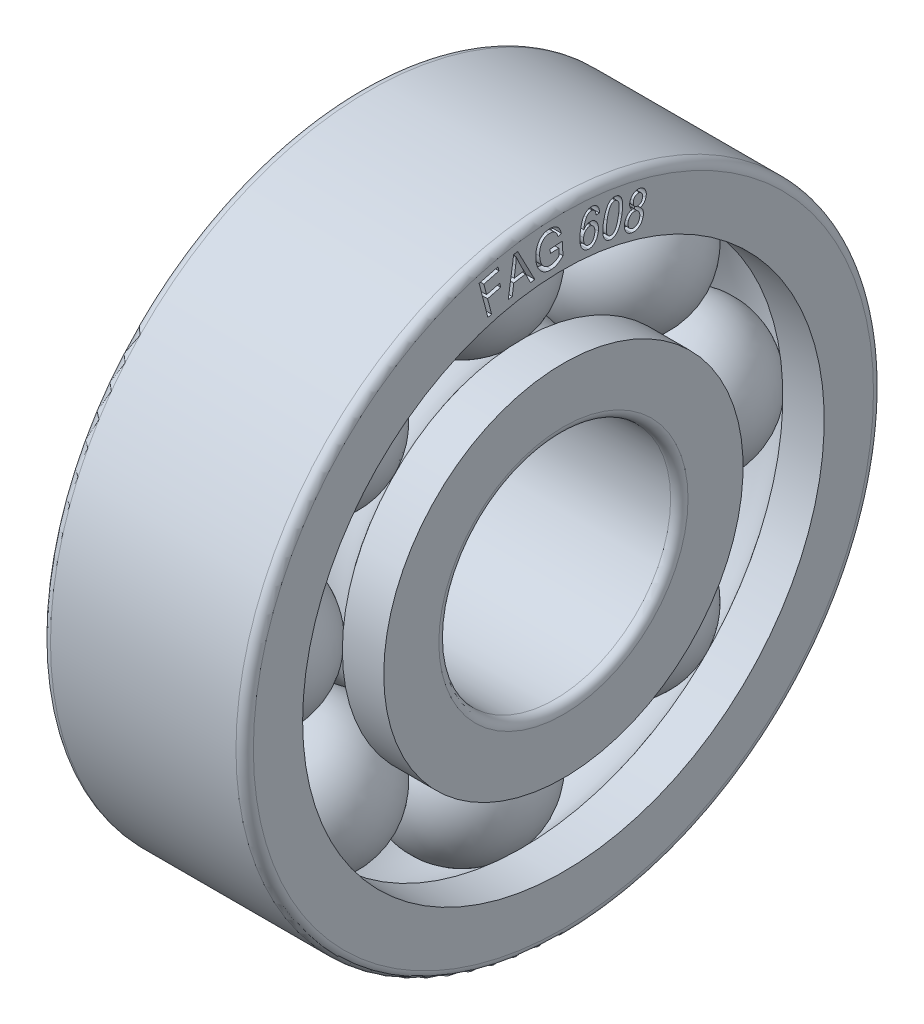
from build123d import *

# Parameters (mm, degrees)
FILLET1_R          = 0.3
FILLET2_R          = 0.3
CIRPATTERN2_COUNT  = 8
CUT_EXTRUDE1_DEPTH = 0.3


with BuildPart() as part:
    # Sketch1 → Revolve1 (revolve)
    with BuildSketch(Plane.XY, mode=Mode.PRIVATE) as revolve1_sk:
        with BuildLine():
            Line((0, 9), (1.428768482, 9))
            ThreePointArc((1.428768482, 9), (3.5, 10.1), (5.571231518, 9))
            Line((5.571231518, 9), (7, 9))
            Line((7, 9), (7, 11))
            Line((7, 11), (0, 11))
            Line((0, 11), (0, 9))
        make_face()
        with BuildLine():
            Line((0, 4), (7, 4))
            Line((7, 4), (7, 6.2))
            Line((7, 6.2), (5.571231518, 6.2))
            ThreePointArc((5.571231518, 6.2), (3.5, 5.1), (1.428768482, 6.2))
            Line((1.428768482, 6.2), (0, 6.2))
            Line((0, 6.2), (0, 4))
        make_face()
    revolve(revolve1_sk.sketch.rotate(Axis((0, 0, 0), (1, 0, 0)), 90), axis=Axis((0, 0, 0), (1, 0, 0)))

    # Fillet1
    fillet1_edges = [part.edges().sort_by_distance(p)[0] for p in [
        (0, 0, -11),
        (7, 0, -11),
    ]]
    fillet(fillet1_edges, radius=FILLET1_R)

    # Fillet2
    fillet2_edges = [part.edges().sort_by_distance(p)[0] for p in [
        (7, 0, -4),
        (0, 0, -4),
    ]]
    fillet(fillet2_edges, radius=FILLET2_R)

    # Sketch4 → Cut-Extrude1 (cut)
    # profile 1 of 6: a face of its own
    with BuildSketch(Plane(origin=(7, 0, 0), x_dir=(0, 0, -1), z_dir=(1, 0, 0))):
        Polygon((-2.605882516, 8.870689693), (-2.908804594, 10.041955927), (-2.260833815, 10.209488394), (-2.22503836, 10.071420212), (-2.746142256, 9.936517615), (-2.652392256, 9.57369294), (-2.201661737, 9.69033255), (-2.165866282, 9.552020862), (-2.616596802, 9.435381251), (-2.479015633, 8.903319563), align=None)
    # profile 2 of 6: a face of its own
    with BuildSketch(Plane(origin=(7, 0, 0), x_dir=(0, 0, -1), z_dir=(1, 0, 0))):
        Polygon((-1.903603379, 9.052119766), (-1.716590392, 10.305447689), (-1.577304678, 10.327363273), (-0.987531951, 9.197249637), (-1.135827405, 9.173873013), (-1.30701247, 9.517217169), (-1.715616366, 9.452687948), (-1.766022211, 9.073791844), align=None)
        with BuildLine():
            Line((-1.698570912, 9.587103533), (-1.367158574, 9.639700935))
            Line((-1.367158574, 9.639700935), (-1.521298185, 9.954067818))
            add(Edge.make_bspline(
                [(-1.521298185, 9.954067818), (-1.52707652, 9.965829821), (-1.538377475, 9.988833312), (-1.554608606, 10.022520569), (-1.569804443, 10.054575375), (-1.58385352, 10.084967443), (-1.597075906, 10.113632661), (-1.609004287, 10.14078287), (-1.619947135, 10.166162877), (-1.62667912, 10.182629278), (-1.629902081, 10.190512624)],
                knots=[0, 0, 0, 0, 1.208512439, 2.363543404, 3.44840734, 4.479897232, 5.451267873, 6.359500996, 7.214605483, 8, 8, 8, 8], degree=3))
            add(Edge.make_bspline(
                [(-1.629902081, 10.190512624), (-1.630141185, 10.170863807), (-1.630619742, 10.13153752), (-1.63435187, 10.072519589), (-1.63921411, 10.013371371), (-1.644204602, 9.974019982), (-1.646704029, 9.954311325)],
                knots=[0, 0, 0, 0, 0.994985304, 1.99142155, 2.994028262, 4, 4, 4, 4], degree=3))
            Line((-1.646704029, 9.954311325), (-1.698570912, 9.587103533))
        make_face(mode=Mode.SUBTRACT)
    # profile 3 of 6: a face of its own
    with BuildSketch(Plane(origin=(7, 0, 0), x_dir=(0, 0, -1), z_dir=(1, 0, 0))):
        with BuildLine():
            Line((-0.45129376, 9.701738735), (-0.459329474, 9.842972501))
            Line((-0.459329474, 9.842972501), (-0.041228825, 9.868297176))
            Line((-0.041228825, 9.868297176), (-0.015417137, 9.421219254))
            add(Edge.make_bspline(
                [(-0.015417137, 9.421219254), (-0.030526573, 9.405399862), (-0.060023027, 9.374517441), (-0.107213614, 9.333121636), (-0.155729329, 9.297703675), (-0.205328593, 9.268014506), (-0.256024935, 9.244113034), (-0.307877218, 9.226332745), (-0.360764702, 9.213968954), (-0.396606369, 9.210739541), (-0.414524279, 9.209125098)],
                knots=[0, 0, 0, 0, 1.131868947, 2.209620481, 3.244052994, 4.236904487, 5.197297732, 6.139274313, 7.069788925, 8, 8, 8, 8], degree=3))
            add(Edge.make_bspline(
                [(-0.414524279, 9.209125098), (-0.426455438, 9.208618682), (-0.449999013, 9.207619378), (-0.484977839, 9.209288341), (-0.519096145, 9.212765306), (-0.552343721, 9.218999412), (-0.584862588, 9.227190772), (-0.616478694, 9.237987415), (-0.647320061, 9.25084217), (-0.677019842, 9.266319391), (-0.705787216, 9.283716401), (-0.733040385, 9.3036469), (-0.759344836, 9.325239031), (-0.783778005, 9.349564831), (-0.807416231, 9.375588413), (-0.829138454, 9.404238104), (-0.849973985, 9.434683453), (-0.869216181, 9.467362978), (-0.886671632, 9.502110273), (-0.90229859, 9.538782445), (-0.915960657, 9.577227329), (-0.927293549, 9.617635865), (-0.937084753, 9.659785625), (-0.944895577, 9.703909969), (-0.950397459, 9.74994075), (-0.95271411, 9.781273577), (-0.953891163, 9.79719328)],
                knots=[0, 0, 0, 0, 0.958083196, 1.890570977, 2.807914002, 3.708822048, 4.603204431, 5.497373219, 6.387950714, 7.282522916, 8.183124656, 9.083655694, 9.990410729, 10.911839729, 11.848415395, 12.810124692, 13.794970561, 14.808428963, 15.851526413, 16.91403715, 18.006177179, 19.123940381, 20.280798938, 21.478330937, 22.718780672, 24, 24, 24, 24], degree=3))
            add(Edge.make_bspline(
                [(-0.953891163, 9.79719328), (-0.954585255, 9.81334215), (-0.955955592, 9.845224619), (-0.955805003, 9.892363342), (-0.953079121, 9.938117865), (-0.948208125, 9.982318548), (-0.941444359, 10.025093604), (-0.932484169, 10.066440099), (-0.920975289, 10.106225499), (-0.907706676, 10.144497817), (-0.892273201, 10.180632473), (-0.875754602, 10.214836756), (-0.857938802, 10.246856656), (-0.837937781, 10.275992997), (-0.817312119, 10.303361799), (-0.794884453, 10.328186814), (-0.770985398, 10.350620343), (-0.745749811, 10.370757108), (-0.71904163, 10.388540876), (-0.691031629, 10.40448098), (-0.661458268, 10.418010508), (-0.630755751, 10.429790277), (-0.598680605, 10.439309329), (-0.565227921, 10.446590868), (-0.53039292, 10.451701663), (-0.506665163, 10.45350382), (-0.494637916, 10.454417306)],
                knots=[0, 0, 0, 0, 1.288788382, 2.544435246, 3.756851362, 4.941904795, 6.088967267, 7.208697424, 8.312887447, 9.3895906, 10.436627236, 11.443983162, 12.417782448, 13.354839462, 14.259715242, 15.148758618, 16.018750214, 16.870862614, 17.719946212, 18.57492971, 19.437886902, 20.310570787, 21.195221232, 22.10293967, 23.038408317, 24, 24, 24, 24], degree=3))
            add(Edge.make_bspline(
                [(-0.494637916, 10.454417306), (-0.477018638, 10.454956432), (-0.442845474, 10.456002084), (-0.392904717, 10.451307292), (-0.346134649, 10.441385271), (-0.302452022, 10.426220791), (-0.262101559, 10.406141798), (-0.224918936, 10.381581965), (-0.191240695, 10.352498684), (-0.166152604, 10.324655714), (-0.147645334, 10.300133667), (-0.134589142, 10.279632046), (-0.122168634, 10.257429261), (-0.110435842, 10.233460183), (-0.09955503, 10.207658598), (-0.089349106, 10.180107202), (-0.079818107, 10.150868168), (-0.074263565, 10.13065898), (-0.07142363, 10.120326397)],
                knots=[0, 0, 0, 0, 1.424245918, 2.762371325, 4.044472707, 5.281536753, 6.490798452, 7.679438468, 8.875376141, 10.078853575, 10.702344892, 11.357732068, 12.042370328, 12.758556972, 13.514336184, 14.305532837, 15.133650363, 16, 16, 16, 16], degree=3))
            Line((-0.07142363, 10.120326397), (-0.186602202, 10.074060163))
            add(Edge.make_bspline(
                [(-0.186602202, 10.074060163), (-0.191462526, 10.089813969), (-0.200648621, 10.119588924), (-0.21741869, 10.160214516), (-0.23505729, 10.19456687), (-0.254404393, 10.22294333), (-0.275905671, 10.24633852), (-0.299670657, 10.26646237), (-0.326292528, 10.283365979), (-0.355304768, 10.297613776), (-0.386595452, 10.308213747), (-0.419627461, 10.315637252), (-0.454392322, 10.319058609), (-0.477994458, 10.318392708), (-0.490011292, 10.31805367)],
                knots=[0, 0, 0, 0, 1.386372001, 2.620266177, 3.692389597, 4.630008934, 5.500015116, 6.357741035, 7.242337583, 8.146331139, 9.070601563, 10.014960388, 10.989333315, 12, 12, 12, 12], degree=3))
            add(Edge.make_bspline(
                [(-0.490011292, 10.31805367), (-0.498869908, 10.317350793), (-0.516244458, 10.315972229), (-0.541732252, 10.312078843), (-0.566113312, 10.306422441), (-0.589486212, 10.299415057), (-0.611827367, 10.290869286), (-0.633098684, 10.280621777), (-0.653290026, 10.268601123), (-0.672648643, 10.255278366), (-0.690728219, 10.240015753), (-0.707830858, 10.223167079), (-0.723901418, 10.204570502), (-0.739128397, 10.184336557), (-0.752901209, 10.162052982), (-0.765816966, 10.138143846), (-0.777782647, 10.112568379), (-0.788442827, 10.085219953), (-0.79797225, 10.056408096), (-0.805714801, 10.025958046), (-0.812091435, 9.994190118), (-0.816527678, 9.96082297), (-0.820163174, 9.926165416), (-0.821378584, 9.889980546), (-0.821477571, 9.852453183), (-0.820312802, 9.82697978), (-0.819719085, 9.813995228)],
                knots=[0, 0, 0, 0, 0.942080174, 1.847717615, 2.730868469, 3.593997165, 4.433148395, 5.264628693, 6.094191337, 6.922681733, 7.753582742, 8.599547696, 9.465888801, 10.357554161, 11.281732922, 12.24064703, 13.237921386, 14.273601438, 15.351411056, 16.453618284, 17.603100446, 18.784992005, 20.021647621, 21.296499246, 22.621945284, 24, 24, 24, 24], degree=3))
            add(Edge.make_bspline(
                [(-0.819719085, 9.813995228), (-0.818373846, 9.794485195), (-0.815769408, 9.756712976), (-0.807423718, 9.702200774), (-0.797100713, 9.651465698), (-0.783110504, 9.604861366), (-0.766630812, 9.56204017), (-0.746950626, 9.523239261), (-0.72422215, 9.488313364), (-0.698520144, 9.457628153), (-0.6707885, 9.430619905), (-0.640817625, 9.407993682), (-0.609536547, 9.388714743), (-0.576412825, 9.373550636), (-0.541600332, 9.362248204), (-0.505062603, 9.355103341), (-0.466875146, 9.351141042), (-0.440911138, 9.352074506), (-0.42767363, 9.352550423)],
                knots=[0, 0, 0, 0, 1.372035112, 2.65631598, 3.867528764, 5.003089876, 6.067389582, 7.083992607, 8.0510349, 8.985440519, 9.88795355, 10.76191017, 11.615862123, 12.462197619, 13.312569365, 14.17846713, 15.071308389, 16, 16, 16, 16], degree=3))
            add(Edge.make_bspline(
                [(-0.42767363, 9.352550423), (-0.414720152, 9.353783351), (-0.388463787, 9.356282465), (-0.349362135, 9.365896327), (-0.310148605, 9.379904945), (-0.271612605, 9.398238457), (-0.235115275, 9.419573541), (-0.201716428, 9.442350032), (-0.172619495, 9.466854924), (-0.156294386, 9.485149294), (-0.148371682, 9.494027696)],
                knots=[0, 0, 0, 0, 0.973018992, 1.972284352, 3.004358147, 4.08617676, 5.161714283, 6.166286297, 7.110084249, 8, 8, 8, 8], degree=3))
            Line((-0.148371682, 9.494027696), (-0.161277526, 9.718540683))
            Line((-0.161277526, 9.718540683), (-0.45129376, 9.701738735))
        make_face()
    # profile 4 of 6: a face of its own
    with BuildSketch(Plane(origin=(7, 0, 0), x_dir=(0, 0, -1), z_dir=(1, 0, 0))):
        with BuildLine():
            Line((1.244067822, 10.066074717), (1.123288601, 10.067535756))
            add(Edge.make_bspline(
                [(1.123288601, 10.067535756), (1.121955692, 10.082108087), (1.119458783, 10.109406122), (1.111712109, 10.146842695), (1.101773698, 10.178390938), (1.091675787, 10.195833361), (1.087006134, 10.203899392)],
                knots=[0, 0, 0, 0, 1.231404287, 2.306763084, 3.216983698, 4, 4, 4, 4], degree=3))
            add(Edge.make_bspline(
                [(1.087006134, 10.203899392), (1.083430353, 10.208827729), (1.076409925, 10.21850367), (1.064812381, 10.23170562), (1.052169061, 10.242943336), (1.039087153, 10.252908928), (1.024809697, 10.260644159), (1.009874839, 10.266774392), (0.994114095, 10.271289965), (0.983216935, 10.272782663), (0.977671718, 10.273542249)],
                knots=[0, 0, 0, 0, 1.089592867, 2.139227712, 3.137010312, 4.113302816, 5.075660011, 6.033400503, 6.999260375, 8, 8, 8, 8], degree=3))
            add(Edge.make_bspline(
                [(0.977671718, 10.273542249), (0.96906528, 10.274075984), (0.952022462, 10.275132907), (0.926580184, 10.271607581), (0.902261232, 10.263568758), (0.878599904, 10.251756057), (0.856314382, 10.235035843), (0.834418665, 10.21470537), (0.813705959, 10.18990771), (0.801428596, 10.171240199), (0.795041848, 10.161529262)],
                knots=[0, 0, 0, 0, 0.911104088, 1.804205243, 2.698132578, 3.612633302, 4.590486022, 5.636086552, 6.770279963, 8, 8, 8, 8], degree=3))
            add(Edge.make_bspline(
                [(0.795041848, 10.161529262), (0.789510139, 10.152124395), (0.778045011, 10.132631683), (0.763696503, 10.100437688), (0.750261369, 10.065000552), (0.738106315, 10.025978958), (0.727555181, 9.983329549), (0.718089464, 9.937184815), (0.709749145, 9.887571792), (0.705613916, 9.85318861), (0.703483406, 9.835474068)],
                knots=[0, 0, 0, 0, 0.766972516, 1.589642198, 2.475081712, 3.432175546, 4.46244358, 5.56428186, 6.745094892, 8, 8, 8, 8], degree=3))
            add(Edge.make_bspline(
                [(0.703483406, 9.835474068), (0.711885144, 9.847148312), (0.728209127, 9.869830543), (0.756753866, 9.899180816), (0.787198108, 9.923680104), (0.819669551, 9.943036506), (0.853553712, 9.957037588), (0.887859787, 9.966572592), (0.922732526, 9.970715772), (0.945852652, 9.969193105), (0.957460679, 9.968428613)],
                knots=[0, 0, 0, 0, 1.143851166, 2.222422067, 3.247817342, 4.247496577, 5.220823449, 6.158285008, 7.075321688, 8, 8, 8, 8], degree=3))
            add(Edge.make_bspline(
                [(0.957460679, 9.968428613), (0.967000562, 9.967022815), (0.985825023, 9.964248842), (1.013255969, 9.95629009), (1.039328668, 9.94506235), (1.064123654, 9.930599971), (1.087385213, 9.912735354), (1.109724939, 9.892062084), (1.130233858, 9.867684231), (1.149803686, 9.840871594), (1.166843857, 9.81125906), (1.18174777, 9.779707416), (1.193058925, 9.745907938), (1.201540775, 9.710291918), (1.207254478, 9.672745324), (1.209376509, 9.633318484), (1.20939427, 9.591888863), (1.206722744, 9.563789528), (1.20535029, 9.549353938)],
                knots=[0, 0, 0, 0, 0.854467177, 1.686067385, 2.524494276, 3.366529178, 4.22462751, 5.121034408, 6.06035018, 7.045312965, 8.061455112, 9.085623302, 10.135082169, 11.215873592, 12.329653121, 13.498065526, 14.714670555, 16, 16, 16, 16], degree=3))
            add(Edge.make_bspline(
                [(1.20535029, 9.549353938), (1.20275275, 9.529880984), (1.197670015, 9.491777286), (1.183281262, 9.436752827), (1.163834537, 9.385127733), (1.143163599, 9.344961551), (1.124721041, 9.315099007), (1.110240132, 9.294448963), (1.095182089, 9.275519447), (1.079616368, 9.25805816), (1.063165567, 9.242548863), (1.046504607, 9.22821319), (1.028776739, 9.216134823), (1.005031016, 9.201860257), (0.973965171, 9.188137244), (0.935236259, 9.177572122), (0.895296065, 9.172558153), (0.868503097, 9.174397272), (0.854944445, 9.175327964)],
                knots=[0, 0, 0, 0, 1.65128912, 3.231159628, 4.77190464, 6.283462097, 7.022414354, 7.723289725, 8.403609653, 9.056265332, 9.68889923, 10.304350955, 10.902867261, 11.490694916, 12.633881442, 13.745328694, 14.85901772, 16, 16, 16, 16], degree=3))
            add(Edge.make_bspline(
                [(0.854944445, 9.175327964), (0.842869013, 9.177051998), (0.81913456, 9.180440614), (0.784980778, 9.190720054), (0.752807238, 9.204547906), (0.722817913, 9.222753587), (0.695265738, 9.245220343), (0.669415133, 9.271235706), (0.645798525, 9.301420308), (0.624169094, 9.335681722), (0.605573298, 9.374771252), (0.590545483, 9.418966478), (0.579179289, 9.46832375), (0.572028363, 9.522956869), (0.567508994, 9.582710746), (0.567349084, 9.647768735), (0.570526373, 9.717974182), (0.575179112, 9.766334858), (0.577590549, 9.791399392)],
                knots=[0, 0, 0, 0, 0.772909589, 1.519165982, 2.254829535, 2.989591428, 3.736700117, 4.504998772, 5.311634248, 6.163142303, 7.070623194, 8.050961107, 9.118927545, 10.278289069, 11.543295626, 12.918227509, 14.402768579, 16, 16, 16, 16], degree=3))
            add(Edge.make_bspline(
                [(0.577590549, 9.791399392), (0.580808324, 9.819197276), (0.587009583, 9.87276904), (0.600346432, 9.949502274), (0.61542617, 10.019797483), (0.633108454, 10.083511823), (0.653143427, 10.140738869), (0.67577856, 10.191325661), (0.700382362, 10.235726772), (0.728244198, 10.273223617), (0.757740654, 10.305192114), (0.788398795, 10.332327916), (0.820236861, 10.35482926), (0.853477145, 10.372328179), (0.887929016, 10.38510506), (0.923723031, 10.392978973), (0.960695329, 10.39600443), (0.985549805, 10.394240167), (0.998126264, 10.393347444)],
                knots=[0, 0, 0, 0, 1.639496436, 3.159618802, 4.561854007, 5.850917759, 7.031856648, 8.111234935, 9.095292884, 9.999984933, 10.841478238, 11.640171367, 12.39494198, 13.120445223, 13.835251806, 14.54152536, 15.262006351, 16, 16, 16, 16], degree=3))
            add(Edge.make_bspline(
                [(0.998126264, 10.393347444), (1.007245751, 10.392134025), (1.02515139, 10.389751539), (1.051124531, 10.383385681), (1.075573155, 10.374573105), (1.098640209, 10.363521103), (1.120369531, 10.350357819), (1.14078269, 10.334946818), (1.159510313, 10.316953015), (1.177051933, 10.297134172), (1.19276337, 10.275036889), (1.20627078, 10.250877701), (1.218153993, 10.224891183), (1.227522753, 10.196866158), (1.234820484, 10.166877555), (1.240142391, 10.135061579), (1.243303432, 10.101202684), (1.243808036, 10.078013313), (1.244067822, 10.066074717)],
                knots=[0, 0, 0, 0, 0.973121059, 1.910672523, 2.823660621, 3.718896915, 4.613143542, 5.508256188, 6.419707335, 7.357101373, 8.305763323, 9.282819564, 10.282387016, 11.325520506, 12.404743799, 13.545817262, 14.736511811, 16, 16, 16, 16], degree=3))
        make_face()
        with BuildLine():
            add(Edge.make_bspline(
                [(0.697152238, 9.604386405), (0.696182342, 9.593843378), (0.694290009, 9.57327322), (0.694164295, 9.542914317), (0.69580106, 9.513951702), (0.699359704, 9.486318693), (0.705220458, 9.460067178), (0.713292587, 9.435241057), (0.723207651, 9.411662607), (0.73548334, 9.389887573), (0.748859011, 9.369878342), (0.763399965, 9.352129639), (0.778689069, 9.336626718), (0.795166903, 9.323753836), (0.812194471, 9.312723226), (0.830456369, 9.30484575), (0.849341283, 9.298684273), (0.862450788, 9.296809813), (0.869067822, 9.295863678)],
                knots=[0, 0, 0, 0, 1.298898157, 2.534237995, 3.721776442, 4.85736778, 5.949796684, 7.017787071, 8.057717091, 9.083377454, 10.080831349, 11.00816266, 11.895739961, 12.746785049, 13.57045205, 14.377627613, 15.181106169, 16, 16, 16, 16], degree=3))
            add(Edge.make_bspline(
                [(0.869067822, 9.295863678), (0.874912279, 9.295445644), (0.886623657, 9.294607969), (0.904153212, 9.296501575), (0.921510053, 9.300415824), (0.938569277, 9.306756248), (0.955319016, 9.315759824), (0.97182457, 9.327008552), (0.98823216, 9.340506729), (1.004208517, 9.35623769), (1.019291456, 9.374203891), (1.032846659, 9.394264862), (1.045245807, 9.416058265), (1.055483675, 9.440006267), (1.064693028, 9.465723659), (1.071761247, 9.493484652), (1.077727119, 9.523060914), (1.080318227, 9.543488947), (1.081648991, 9.553980561)],
                knots=[0, 0, 0, 0, 0.760056361, 1.523034341, 2.280378171, 3.067964229, 3.879480982, 4.74537868, 5.659643971, 6.636668771, 7.654895734, 8.702205358, 9.778896983, 10.907643094, 12.081843924, 13.325159972, 14.626231453, 16, 16, 16, 16], degree=3))
            add(Edge.make_bspline(
                [(1.081648991, 9.553980561), (1.082604782, 9.564281119), (1.084461021, 9.584285803), (1.084790796, 9.613647334), (1.083848531, 9.641504841), (1.0802672, 9.667763185), (1.075412503, 9.692553873), (1.067883451, 9.715523757), (1.059038741, 9.737094363), (1.047960589, 9.756811704), (1.035635323, 9.774727478), (1.022246059, 9.790804939), (1.00748239, 9.804349262), (0.992122883, 9.81636413), (0.975429895, 9.825719479), (0.957979316, 9.833487996), (0.93937656, 9.838898336), (0.926484401, 9.840666832), (0.919960679, 9.84156173)],
                knots=[0, 0, 0, 0, 1.347448063, 2.616875003, 3.823822348, 4.975705693, 6.066838922, 7.11049267, 8.120203093, 9.10028325, 10.050868773, 10.95147544, 11.819570317, 12.657299796, 13.486438328, 14.305872649, 15.142733633, 16, 16, 16, 16], degree=3))
            add(Edge.make_bspline(
                [(0.919960679, 9.84156173), (0.913550352, 9.842044929), (0.900805965, 9.843005578), (0.881683525, 9.841629124), (0.862897041, 9.838392193), (0.844609511, 9.832236783), (0.826641696, 9.824352488), (0.809202666, 9.813867779), (0.792047034, 9.801372068), (0.77542298, 9.78668566), (0.759931487, 9.769960311), (0.745871136, 9.751469535), (0.733473146, 9.731242427), (0.722744999, 9.709214867), (0.71374487, 9.685488834), (0.706425817, 9.659997471), (0.700904004, 9.632779093), (0.69842013, 9.613981584), (0.697152238, 9.604386405)],
                knots=[0, 0, 0, 0, 0.851085556, 1.692045296, 2.53410559, 3.37113285, 4.242914067, 5.130487322, 6.062345295, 7.053266852, 8.065856458, 9.079417372, 10.127566914, 11.205447051, 12.322462635, 13.487070782, 14.717276591, 16, 16, 16, 16], degree=3))
        make_face(mode=Mode.SUBTRACT)
    # profile 5 of 6: a face of its own
    with BuildSketch(Plane(origin=(7, 0, 0), x_dir=(0, 0, -1), z_dir=(1, 0, 0))):
        with BuildLine():
            add(Edge.make_bspline(
                [(1.385287188, 9.741763466), (1.389834899, 9.765740241), (1.398653531, 9.812234472), (1.414106772, 9.879335607), (1.431691297, 9.941353895), (1.450459501, 9.998640566), (1.4715197, 10.050743038), (1.493629308, 10.098266811), (1.518133143, 10.140482229), (1.543802062, 10.178032692), (1.571381355, 10.210469243), (1.600718021, 10.23770258), (1.631566353, 10.260036508), (1.66419067, 10.276722062), (1.6983485, 10.288154964), (1.733970088, 10.294148841), (1.771241398, 10.295349112), (1.796192374, 10.291744968), (1.808988487, 10.289896583)],
                knots=[0, 0, 0, 0, 1.517443063, 2.942528765, 4.279897011, 5.524839292, 6.688905745, 7.772595772, 8.781149016, 9.720601668, 10.597618134, 11.422669461, 12.204194647, 12.958129112, 13.692325841, 14.434974779, 15.19737653, 16, 16, 16, 16], degree=3))
            add(Edge.make_bspline(
                [(1.808988487, 10.289896583), (1.820186608, 10.287590179), (1.842163403, 10.283063762), (1.873346294, 10.271391679), (1.901992376, 10.256253749), (1.928169901, 10.237619247), (1.951386933, 10.215051852), (1.972509928, 10.189380994), (1.990958711, 10.159918629), (2.00056485, 10.138324324), (2.005498227, 10.127234245)],
                knots=[0, 0, 0, 0, 1.02585359, 2.013281854, 2.978793878, 3.929852435, 4.889093848, 5.878754199, 6.910602451, 8, 8, 8, 8], degree=3))
            add(Edge.make_bspline(
                [(2.005498227, 10.127234245), (2.011023956, 10.112565541), (2.022524315, 10.082036476), (2.033779485, 10.032200597), (2.041248491, 9.97753925), (2.044415389, 9.917778258), (2.043798653, 9.853058803), (2.039272708, 9.783163327), (2.030777653, 9.708228149), (2.022140741, 9.656824516), (2.017673552, 9.630237492)],
                knots=[0, 0, 0, 0, 0.746789946, 1.554247666, 2.429589935, 3.375639317, 4.405323851, 5.514587416, 6.714493111, 8, 8, 8, 8], degree=3))
            add(Edge.make_bspline(
                [(2.017673552, 9.630237492), (2.013237321, 9.606335053), (2.004632971, 9.559974766), (1.988997445, 9.493201204), (1.971843647, 9.431326954), (1.952905139, 9.374282824), (1.932017653, 9.322270493), (1.909672978, 9.274866459), (1.885405925, 9.232520877), (1.859567945, 9.19491974), (1.832135669, 9.162379797), (1.80303377, 9.13492982), (1.772040697, 9.1129707), (1.7394049, 9.096225087), (1.705185749, 9.084630825), (1.669423211, 9.078251416), (1.632040232, 9.077153987), (1.607010838, 9.08075205), (1.594215759, 9.082591388)],
                knots=[0, 0, 0, 0, 1.512704229, 2.933985139, 4.266170129, 5.507295043, 6.672271838, 7.75224752, 8.765965807, 9.706153144, 10.587698793, 11.409694417, 12.188905677, 12.943429745, 13.68459684, 14.428701438, 15.196748849, 16, 16, 16, 16], degree=3))
            add(Edge.make_bspline(
                [(1.594215759, 9.082591388), (1.582922558, 9.084943043), (1.560692064, 9.089572241), (1.529286111, 9.102082193), (1.500213978, 9.118284545), (1.473466316, 9.138483696), (1.44898477, 9.162527435), (1.426881356, 9.190583882), (1.407557583, 9.222798653), (1.389932107, 9.258841607), (1.37572181, 9.29997673), (1.365805621, 9.346590094), (1.359302053, 9.398721222), (1.356866893, 9.456516643), (1.358215774, 9.51993844), (1.363593421, 9.588903681), (1.372288479, 9.663584793), (1.38083906, 9.715010908), (1.385287188, 9.741763466)],
                knots=[0, 0, 0, 0, 0.717921777, 1.413218011, 2.097304442, 2.787445265, 3.495872465, 4.230763483, 5.007403457, 5.833387177, 6.727863268, 7.712409527, 8.798744903, 9.999179504, 11.31493902, 12.750764746, 14.309704011, 16, 16, 16, 16], degree=3))
        make_face()
        with BuildLine():
            add(Edge.make_bspline(
                [(1.507040435, 9.720334894), (1.503172233, 9.697303565), (1.495763423, 9.653191392), (1.487260169, 9.589604575), (1.481178918, 9.531636967), (1.478247144, 9.479224035), (1.477704215, 9.432467536), (1.480327568, 9.391282025), (1.485328251, 9.355663806), (1.493469506, 9.325222337), (1.503924676, 9.299345584), (1.515630429, 9.27658788), (1.529005661, 9.256769687), (1.543914482, 9.239831558), (1.560235642, 9.225646623), (1.578110758, 9.214246141), (1.597808928, 9.206196154), (1.611613941, 9.203021416), (1.618566409, 9.201422557)],
                knots=[0, 0, 0, 0, 1.922278581, 3.681762532, 5.280026575, 6.718786946, 8.001654205, 9.126551397, 10.11306448, 10.957502634, 11.713104281, 12.406437687, 13.060611741, 13.67596391, 14.258635994, 14.835146138, 15.413357362, 16, 16, 16, 16], degree=3))
            add(Edge.make_bspline(
                [(1.618566409, 9.201422557), (1.625290635, 9.200553582), (1.638639708, 9.198828474), (1.658925171, 9.200138107), (1.678852631, 9.204909681), (1.698461514, 9.212783806), (1.717699383, 9.223963205), (1.736447476, 9.23852564), (1.754933572, 9.25623341), (1.773679831, 9.277203036), (1.791572634, 9.303225533), (1.808574515, 9.335021119), (1.824703685, 9.372898073), (1.840088961, 9.416900674), (1.85529057, 9.46688443), (1.869031587, 9.523154812), (1.882867644, 9.585377476), (1.890799821, 9.629069857), (1.894946279, 9.65190957)],
                knots=[0, 0, 0, 0, 0.562003764, 1.115701597, 1.676451113, 2.25717821, 2.864105632, 3.517910156, 4.223509854, 4.98752976, 5.849446084, 6.838650486, 7.976755095, 9.264339606, 10.707826169, 12.313067606, 14.072696507, 16, 16, 16, 16], degree=3))
            add(Edge.make_bspline(
                [(1.894946279, 9.65190957), (1.898910976, 9.675019179), (1.90649018, 9.7191972), (1.91501021, 9.782962588), (1.920938627, 9.84102478), (1.924303623, 9.893417435), (1.924742165, 9.940101335), (1.922175516, 9.981129293), (1.917106258, 10.0166539), (1.909053757, 10.04695957), (1.898478236, 10.072829545), (1.886638543, 10.095555262), (1.873214665, 10.115461037), (1.858289297, 10.132565236), (1.841579086, 10.146558518), (1.823313712, 10.157723711), (1.803378275, 10.16585965), (1.789321409, 10.168992083), (1.782202772, 10.170578401)],
                knots=[0, 0, 0, 0, 1.925652475, 3.681218175, 5.282556124, 6.718499414, 7.991843276, 9.114235399, 10.09195988, 10.934517528, 11.68225079, 12.383040181, 13.035757434, 13.649739256, 14.241268889, 14.818654507, 15.401746526, 16, 16, 16, 16], degree=3))
            add(Edge.make_bspline(
                [(1.782202772, 10.170578401), (1.775559877, 10.171444357), (1.762293197, 10.173173778), (1.74216448, 10.17188046), (1.722395016, 10.167095212), (1.702981041, 10.159156918), (1.68380696, 10.14803489), (1.66505888, 10.133551873), (1.646818785, 10.115674151), (1.6281114, 10.094907227), (1.610315949, 10.068857563), (1.593468062, 10.037030046), (1.577348956, 9.999163844), (1.561715349, 9.955261888), (1.547192408, 9.905162876), (1.532784842, 9.849074247), (1.519164561, 9.786854887), (1.51120251, 9.743170453), (1.507040435, 9.720334894)],
                knots=[0, 0, 0, 0, 0.556496921, 1.111392882, 1.666781938, 2.24249974, 2.850740471, 3.50595974, 4.208198195, 4.973871336, 5.828252846, 6.825539704, 7.966107019, 9.250115514, 10.701259935, 12.305089579, 14.068526081, 16, 16, 16, 16], degree=3))
        make_face(mode=Mode.SUBTRACT)
    # profile 6 of 6: a face of its own
    with BuildSketch(Plane(origin=(7, 0, 0), x_dir=(0, 0, -1), z_dir=(1, 0, 0))):
        with BuildLine():
            add(Edge.make_bspline(
                [(2.377254783, 9.603841544), (2.367496279, 9.612342453), (2.348462352, 9.628923444), (2.324866001, 9.657758811), (2.3065139, 9.688878321), (2.293447488, 9.722403254), (2.285839313, 9.758341122), (2.28415343, 9.796664361), (2.287521138, 9.837289267), (2.29386057, 9.864618066), (2.297141147, 9.878760375)],
                knots=[0, 0, 0, 0, 1.017118976, 1.983886887, 2.91730529, 3.849695808, 4.803118384, 5.794558447, 6.858711811, 8, 8, 8, 8], degree=3))
            add(Edge.make_bspline(
                [(2.297141147, 9.878760375), (2.300223458, 9.889446775), (2.306276988, 9.910434416), (2.31796344, 9.940355873), (2.33168812, 9.968165343), (2.347428866, 9.993754576), (2.365450713, 10.017026249), (2.3850775, 10.038441592), (2.407304906, 10.057139351), (2.430956344, 10.074015343), (2.456247033, 10.087902917), (2.482035138, 10.099589587), (2.50862489, 10.107883595), (2.535649792, 10.113267153), (2.563322448, 10.115635132), (2.591474415, 10.115499823), (2.620289516, 10.112021158), (2.639304805, 10.107518867), (2.64900803, 10.105221414)],
                knots=[0, 0, 0, 0, 1.137824568, 2.234639565, 3.282284582, 4.308130742, 5.303384408, 6.29084187, 7.274763873, 8.270398815, 9.259601828, 10.222826767, 11.163397211, 12.103417239, 13.037509036, 14.001163731, 14.980022998, 16, 16, 16, 16], degree=3))
            add(Edge.make_bspline(
                [(2.64900803, 10.105221414), (2.65864636, 10.102398133), (2.677577439, 10.096852801), (2.70454356, 10.085570257), (2.729463729, 10.071858445), (2.752571652, 10.055980371), (2.773637425, 10.03758613), (2.792656939, 10.016774188), (2.809753222, 9.993749919), (2.824848896, 9.968752568), (2.837312414, 9.942095583), (2.847630237, 9.914415747), (2.854170241, 9.885651571), (2.858528073, 9.856094634), (2.85954421, 9.825668064), (2.858204739, 9.794280266), (2.853435134, 9.762039303), (2.848355925, 9.740496011), (2.845761277, 9.729490895)],
                knots=[0, 0, 0, 0, 1.014341474, 1.992313756, 2.946750544, 3.884152928, 4.820118789, 5.766378939, 6.727698943, 7.713789591, 8.71178232, 9.697770621, 10.692522228, 11.68663111, 12.712743684, 13.763796198, 14.857663835, 16, 16, 16, 16], degree=3))
            add(Edge.make_bspline(
                [(2.845761277, 9.729490895), (2.841790444, 9.716140786), (2.834119116, 9.690349458), (2.817535078, 9.654711447), (2.797859272, 9.623118653), (2.774306917, 9.5960191), (2.747007509, 9.573515204), (2.716331822, 9.555359165), (2.681860527, 9.541729913), (2.657304381, 9.536442044), (2.644624913, 9.533711674)],
                knots=[0, 0, 0, 0, 1.118702078, 2.161241791, 3.1499027, 4.102822141, 5.034607916, 5.982709453, 6.958380076, 8, 8, 8, 8], degree=3))
            add(Edge.make_bspline(
                [(2.644624913, 9.533711674), (2.65088143, 9.528946863), (2.663310149, 9.519481453), (2.680190084, 9.503606788), (2.69569652, 9.487030275), (2.709455867, 9.469332833), (2.721504017, 9.450586877), (2.732438024, 9.431021794), (2.741347398, 9.410338959), (2.748647978, 9.388736026), (2.754591961, 9.366403374), (2.758423071, 9.343155504), (2.760498377, 9.319147752), (2.761477881, 9.294408107), (2.759684096, 9.2688814), (2.756883029, 9.24269281), (2.752265589, 9.21566337), (2.747749286, 9.197645803), (2.745436601, 9.188419466)],
                knots=[0, 0, 0, 0, 0.981455837, 1.949685535, 2.889266844, 3.813802417, 4.744374436, 5.669798559, 6.609434538, 7.551799959, 8.515509543, 9.491980542, 10.489477949, 11.523785981, 12.579671552, 13.681084393, 14.812542323, 16, 16, 16, 16], degree=3))
            add(Edge.make_bspline(
                [(2.745436601, 9.188419466), (2.741808853, 9.175859619), (2.734699959, 9.151247489), (2.721074655, 9.116067313), (2.704871032, 9.083559092), (2.686657913, 9.053286205), (2.665630453, 9.025884124), (2.642595471, 9.000740198), (2.617188777, 8.978219326), (2.589483445, 8.958652823), (2.560513992, 8.941999307), (2.530753036, 8.928296135), (2.500331732, 8.918402323), (2.469332182, 8.911661262), (2.437881593, 8.908625368), (2.405814654, 8.908525154), (2.373215702, 8.912155249), (2.351643214, 8.917252763), (2.340728809, 8.919831804)],
                knots=[0, 0, 0, 0, 1.154321464, 2.26199503, 3.326438104, 4.359243017, 5.377286907, 6.371707073, 7.367160402, 8.369739179, 9.362115685, 10.314991934, 11.258109293, 12.181928162, 13.111432125, 14.043421027, 15.010086646, 16, 16, 16, 16], degree=3))
            add(Edge.make_bspline(
                [(2.340728809, 8.919831804), (2.32976835, 8.923001962), (2.308282653, 8.929216397), (2.277923931, 8.942486126), (2.249415626, 8.957689587), (2.223277905, 8.97603558), (2.199513318, 8.99726225), (2.177689144, 9.020851687), (2.158472924, 9.047500635), (2.141201257, 9.076225477), (2.126855806, 9.10706048), (2.115917679, 9.139422023), (2.108006414, 9.172919916), (2.10376225, 9.207613638), (2.102476975, 9.243393401), (2.104790939, 9.280307285), (2.110398751, 9.31841951), (2.116503554, 9.343898608), (2.119624913, 9.356925959)],
                knots=[0, 0, 0, 0, 0.996408907, 1.953252159, 2.889887497, 3.8170413, 4.736862477, 5.670941087, 6.620389359, 7.60362447, 8.597250459, 9.58678916, 10.585040629, 11.600666905, 12.637219942, 13.710544674, 14.829411448, 16, 16, 16, 16], degree=3))
            add(Edge.make_bspline(
                [(2.119624913, 9.356925959), (2.122286122, 9.366371962), (2.127488643, 9.384838386), (2.136811686, 9.411513356), (2.147130682, 9.436562855), (2.158981765, 9.459845973), (2.171709137, 9.481553703), (2.186055273, 9.50131168), (2.201057229, 9.519731402), (2.2174476, 9.536259396), (2.234664632, 9.551147273), (2.252819277, 9.564087135), (2.271669022, 9.575416048), (2.29131879, 9.584849578), (2.311740188, 9.592569286), (2.332917535, 9.598002186), (2.354802074, 9.602071735), (2.369689369, 9.603245209), (2.377254783, 9.603841544)],
                knots=[0, 0, 0, 0, 1.226415581, 2.397576135, 3.529994726, 4.609882479, 5.660834014, 6.671594103, 7.658861706, 8.627392677, 9.577088334, 10.500571714, 11.410581058, 12.322680627, 13.221593616, 14.134595585, 15.052040137, 16, 16, 16, 16], degree=3))
        make_face()
        with BuildLine():
            add(Edge.make_bspline(
                [(2.418407381, 9.851000635), (2.416640744, 9.84404791), (2.413176342, 9.83041351), (2.410525303, 9.809992641), (2.408759813, 9.790396192), (2.409437378, 9.771487382), (2.411251736, 9.753218297), (2.414882376, 9.735656156), (2.420351167, 9.718870561), (2.429514538, 9.697936123), (2.444503529, 9.674391733), (2.467174422, 9.651012369), (2.494415182, 9.633286555), (2.514881926, 9.626684727), (2.525306731, 9.623322063)],
                knots=[0, 0, 0, 0, 0.916496952, 1.797264609, 2.629992531, 3.429517966, 4.212430195, 4.975832735, 5.717690342, 6.465982972, 7.894197209, 9.259465995, 10.60409981, 12, 12, 12, 12], degree=3))
            add(Edge.make_bspline(
                [(2.525306731, 9.623322063), (2.535811121, 9.621238965), (2.556473558, 9.617141451), (2.588275503, 9.618998427), (2.619086343, 9.62815263), (2.648447681, 9.643821741), (2.675235791, 9.665413561), (2.697735122, 9.692736011), (2.715288395, 9.725321465), (2.722790617, 9.74938224), (2.726686601, 9.761877258)],
                knots=[0, 0, 0, 0, 0.940368009, 1.849730864, 2.772873151, 3.751517343, 4.763137974, 5.783813119, 6.849110462, 8, 8, 8, 8], degree=3))
            add(Edge.make_bspline(
                [(2.726686601, 9.761877258), (2.729601288, 9.775041683), (2.735206883, 9.800359822), (2.735621456, 9.838451247), (2.729443069, 9.874430172), (2.718041274, 9.902029765), (2.706954561, 9.922582527), (2.696950551, 9.936178655), (2.686667407, 9.9487624), (2.674944768, 9.95959165), (2.662429963, 9.969067274), (2.648828131, 9.976920885), (2.634393229, 9.983365309), (2.6242111, 9.986343614), (2.619056731, 9.987851284)],
                knots=[0, 0, 0, 0, 1.739154247, 3.344783269, 4.890594828, 6.426078824, 7.182332763, 7.904474628, 8.60447244, 9.280055801, 9.962127506, 10.629841633, 11.306402212, 12, 12, 12, 12], degree=3))
            add(Edge.make_bspline(
                [(2.619056731, 9.987851284), (2.608631337, 9.989987559), (2.588117583, 9.994191048), (2.556476649, 9.991553521), (2.525679707, 9.9822677), (2.496240424, 9.966343883), (2.469270971, 9.944987402), (2.446986728, 9.917930468), (2.429368475, 9.88641346), (2.422127457, 9.863019362), (2.418407381, 9.851000635)],
                knots=[0, 0, 0, 0, 0.942210007, 1.853960059, 2.787951185, 3.785695253, 4.812592251, 5.827292103, 6.883770423, 8, 8, 8, 8], degree=3))
        make_face(mode=Mode.SUBTRACT)
        with BuildLine():
            add(Edge.make_bspline(
                [(2.238943095, 9.325513622), (2.236874596, 9.31677237), (2.232820282, 9.299639288), (2.228909359, 9.274084688), (2.227145413, 9.249326143), (2.227570765, 9.225434376), (2.23033035, 9.202383226), (2.234895639, 9.180092602), (2.241700943, 9.158603326), (2.25077971, 9.138210174), (2.26136288, 9.119128278), (2.273314877, 9.101724667), (2.286586478, 9.086178689), (2.301170325, 9.072591183), (2.316936989, 9.060773065), (2.333839628, 9.050658002), (2.352102154, 9.042606313), (2.3649505, 9.038848067), (2.371410627, 9.036958427)],
                knots=[0, 0, 0, 0, 1.216889673, 2.385135655, 3.498718236, 4.576862791, 5.617841347, 6.640351497, 7.656095091, 8.665686047, 9.660306751, 10.609173721, 11.521840976, 12.424578584, 13.304513363, 14.187330707, 15.088592924, 16, 16, 16, 16], degree=3))
            add(Edge.make_bspline(
                [(2.371410627, 9.036958427), (2.378042744, 9.035454515), (2.391207884, 9.03246916), (2.41112465, 9.030219088), (2.430824094, 9.03049794), (2.450154692, 9.032999996), (2.469338197, 9.03742071), (2.488381709, 9.043897749), (2.506883484, 9.053177878), (2.525212759, 9.06400727), (2.542578591, 9.077096027), (2.558743541, 9.092014101), (2.573472422, 9.108768992), (2.586846151, 9.127275305), (2.59879096, 9.147590421), (2.60931977, 9.169658934), (2.618281588, 9.193576583), (2.623143573, 9.210300369), (2.625631407, 9.218857778)],
                knots=[0, 0, 0, 0, 0.933416659, 1.852886932, 2.744646015, 3.63221579, 4.524462345, 5.444472926, 6.386633105, 7.361520255, 8.364670855, 9.366396217, 10.37719609, 11.422854028, 12.497168646, 13.608934531, 14.776513645, 16, 16, 16, 16], degree=3))
            add(Edge.make_bspline(
                [(2.625631407, 9.218857778), (2.627691648, 9.227599616), (2.631729776, 9.244733848), (2.635755749, 9.270275056), (2.637107733, 9.295057623), (2.636756038, 9.318929681), (2.634085169, 9.342026688), (2.629092158, 9.36423424), (2.622478171, 9.385841607), (2.612979745, 9.406082913), (2.602553746, 9.425346525), (2.590171077, 9.442581148), (2.577110357, 9.458431586), (2.562392334, 9.472087612), (2.546412756, 9.483846832), (2.529320058, 9.493893914), (2.510949405, 9.50206358), (2.498004863, 9.505778163), (2.491459329, 9.507656479)],
                knots=[0, 0, 0, 0, 1.213133398, 2.377773259, 3.487214235, 4.562030792, 5.599796074, 6.62144746, 7.634055675, 8.645000174, 9.6365507, 10.588759785, 11.50696299, 12.406914043, 13.292929268, 14.182465815, 15.080946031, 16, 16, 16, 16], degree=3))
            add(Edge.make_bspline(
                [(2.491459329, 9.507656479), (2.484830039, 9.509184156), (2.471836228, 9.512178495), (2.452053756, 9.514098442), (2.432541093, 9.513857245), (2.413139419, 9.511482294), (2.394057326, 9.506479143), (2.375205887, 9.499375262), (2.356629134, 9.490029006), (2.338447454, 9.478615606), (2.321091639, 9.465327468), (2.304765446, 9.450409143), (2.290280431, 9.433510225), (2.276959617, 9.415167446), (2.265415986, 9.395054474), (2.254691014, 9.373569824), (2.246116275, 9.350117923), (2.241365042, 9.333821), (2.238943095, 9.325513622)],
                knots=[0, 0, 0, 0, 0.939298021, 1.841081266, 2.738459232, 3.631621493, 4.534798746, 5.457679996, 6.410739654, 7.403497371, 8.419738145, 9.427775276, 10.453381387, 11.489968604, 12.55569878, 13.654271247, 14.804261513, 16, 16, 16, 16], degree=3))
        make_face(mode=Mode.SUBTRACT)
    extrude(amount=-CUT_EXTRUDE1_DEPTH, mode=Mode.SUBTRACT)


with BuildPart() as body_2:
    # Sketch2 → Revolve2 (revolve)
    with BuildSketch(Plane.XY):
        with BuildLine():
            Line((3.5, 10.1), (3.5, 5.1))
            ThreePointArc((3.5, 5.1), (1, 7.6), (3.5, 10.1))
        make_face()
    revolve(axis=Axis((3.5, 10.1, 0), (0, -1, 0)))


with BuildPart() as cirpattern2_1:
    # CirPattern2: pattern copy
    add(body_2.part.rotate(Axis((0, 0, 0), (1, 0, 0)), 1 * 360 / CIRPATTERN2_COUNT))


with BuildPart() as cirpattern2_2:
    # CirPattern2: pattern copy
    add(body_2.part.rotate(Axis((0, 0, 0), (1, 0, 0)), 2 * 360 / CIRPATTERN2_COUNT))


with BuildPart() as cirpattern2_3:
    # CirPattern2: pattern copy
    add(body_2.part.rotate(Axis((0, 0, 0), (1, 0, 0)), 3 * 360 / CIRPATTERN2_COUNT))


with BuildPart() as cirpattern2_4:
    # CirPattern2: pattern copy
    add(body_2.part.rotate(Axis((0, 0, 0), (1, 0, 0)), 4 * 360 / CIRPATTERN2_COUNT))


with BuildPart() as cirpattern2_5:
    # CirPattern2: pattern copy
    add(body_2.part.rotate(Axis((0, 0, 0), (1, 0, 0)), 5 * 360 / CIRPATTERN2_COUNT))


with BuildPart() as cirpattern2_6:
    # CirPattern2: pattern copy
    add(body_2.part.rotate(Axis((0, 0, 0), (1, 0, 0)), 6 * 360 / CIRPATTERN2_COUNT))


with BuildPart() as cirpattern2_7:
    # CirPattern2: pattern copy
    add(body_2.part.rotate(Axis((0, 0, 0), (1, 0, 0)), 7 * 360 / CIRPATTERN2_COUNT))


solid = Compound([part.part, body_2.part, cirpattern2_1.part, cirpattern2_2.part, cirpattern2_3.part, cirpattern2_4.part, cirpattern2_5.part, cirpattern2_6.part, cirpattern2_7.part])
